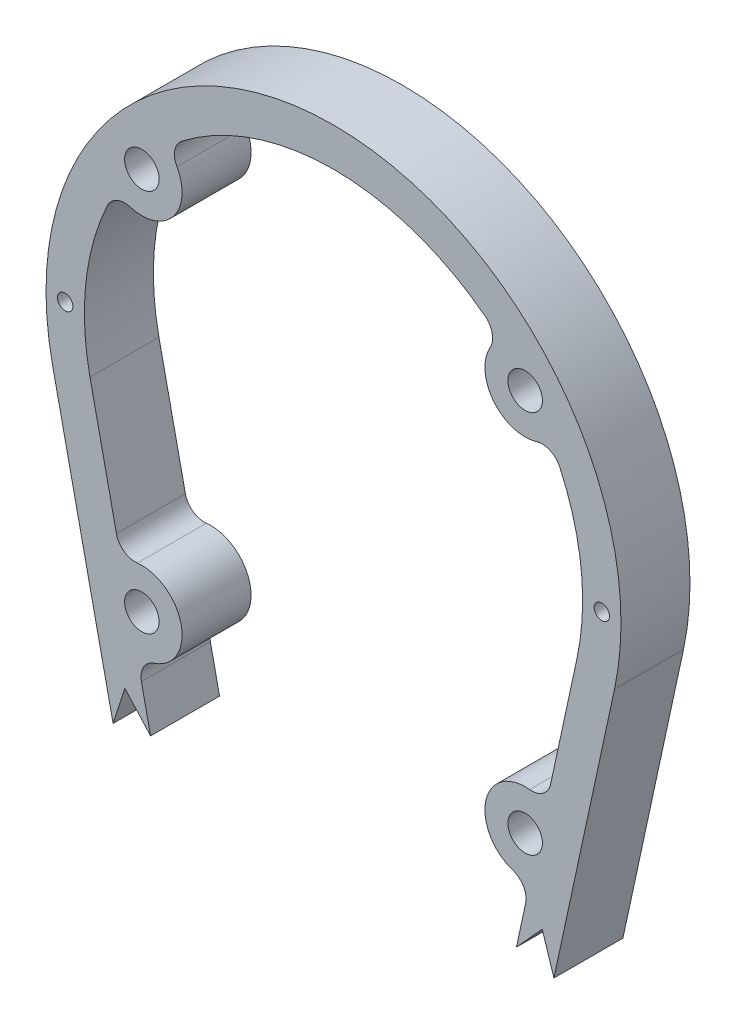
from build123d import *

# Parameters (mm, degrees)
SKETCH3_R           = 4.5
BOSS_EXTRUDE1_DEPTH = 18
FILLET1_R           = 5
FILLET2_R           = 5
CUT_EXTRUDE2_DEPTH  = 145.759283098
SKETCH6_R           = 2
CUT_EXTRUDE3_DEPTH  = 145.759283098


with BuildPart() as part:
    # Sketch3 → Boss-Extrude1 (new body)
    with BuildSketch(Plane.XY):
        with BuildLine():
            Line((-31.929873349, -122.5), (31.929873349, -122.5))
            ThreePointArc((31.929873349, -122.5), (38.210043039, -120.281996444), (41.704324989, -114.611893732))
            Line((41.704324989, -114.611893732), (73.308387301, 31.660797012))
            ThreePointArc((73.308387301, 31.660797012), (0, 122.5), (-73.308387301, 31.660797012))
            Line((-73.308387301, 31.660797012), (-41.704324989, -114.611893732))
            ThreePointArc((-41.704324989, -114.611893732), (-38.210043039, -120.281996444), (-31.929873349, -122.5))
        make_face()
        with Locations((50, -12.5)):
            Circle(SKETCH3_R, mode=Mode.SUBTRACT)
        with Locations((50, 87.5)):
            Circle(SKETCH3_R, mode=Mode.SUBTRACT)
        with Locations((-50, 87.5)):
            Circle(SKETCH3_R, mode=Mode.SUBTRACT)
        with Locations((-50, -12.5)):
            Circle(SKETCH3_R, mode=Mode.SUBTRACT)
        with BuildLine():
            Line((-31.929873349, -112.5), (-51.284518999, -22.921132901))
            ThreePointArc((-51.284518999, -22.921132901), (-39.736825778, -10.282511582), (-55.472323677, -3.538768301))
            Line((-55.472323677, -3.538768301), (-63.533935661, 33.772690744))
            ThreePointArc((-63.533935661, 33.772690744), (-64.271528905, 57.204152316), (-56.648842383, 79.373322021))
            ThreePointArc((-56.648842383, 79.373322021), (-41.800877501, 80.940702001), (-43.531035666, 95.770580418))
            ThreePointArc((-43.531035666, 95.770580418), (0, 112.5), (43.531035666, 95.770580418))
            ThreePointArc((43.531035666, 95.770580418), (41.800877501, 80.940702001), (56.648842383, 79.373322021))
            ThreePointArc((56.648842383, 79.373322021), (64.271528905, 57.204152316), (63.533935661, 33.772690744))
            Line((63.533935661, 33.772690744), (55.472323677, -3.538768301))
            ThreePointArc((55.472323677, -3.538768301), (39.736825778, -10.282511582), (51.284518999, -22.921132901))
            Line((51.284518999, -22.921132901), (31.929873349, -112.5))
            Line((31.929873349, -112.5), (-31.929873349, -112.5))
        make_face(mode=Mode.SUBTRACT)
    extrude(amount=BOSS_EXTRUDE1_DEPTH)

    # Fillet1
    fillet1_edges = [part.edges().sort_by_distance(p)[0] for p in [
        (-31.929873349, -112.5, 9),
        (31.929873349, -112.5, 9),
    ]]
    fillet(fillet1_edges, radius=FILLET1_R)

    # Fillet2
    fillet2_edges = [part.edges().sort_by_distance(p)[0] for p in [
        (51.284518999, -22.921132901, 9),
        (55.472323677, -3.538768301, 9),
        (56.648842383, 79.373322021, 9),
        (43.531035666, 95.770580418, 9),
        (-43.531035666, 95.770580418, 9),
        (-56.648842383, 79.373322021, 9),
        (-55.472323677, -3.538768301, 9),
        (-51.284518999, -22.921132901, 9),
    ]]
    fillet(fillet2_edges, radius=FILLET2_R)

    # Sketch5 → Cut-Extrude2 (cut, through all)
    with BuildSketch(Plane.XY.offset(18)):
        Polygon((47.724403212, -39.39837277), (54.444339069, -31.972010438), (57.506356145, -41.47554836), (70.328868077, -126.043088926), (-63.485047771, -126.043088926), (-57.506356145, -41.47554836), (-54.443982463, -31.973660914), (-47.723687693, -39.401684395), align=None)
    extrude(amount=-CUT_EXTRUDE2_DEPTH, mode=Mode.SUBTRACT)

    # Sketch6 → Cut-Extrude3 (cut, through all)
    with BuildSketch(Plane.XY.offset(18)):
        with Locations((-70, 47.5)):
            Circle(SKETCH6_R)
        with Locations((70, 47.5)):
            Circle(SKETCH6_R)
    extrude(amount=-CUT_EXTRUDE3_DEPTH, mode=Mode.SUBTRACT)


solid = part.part
